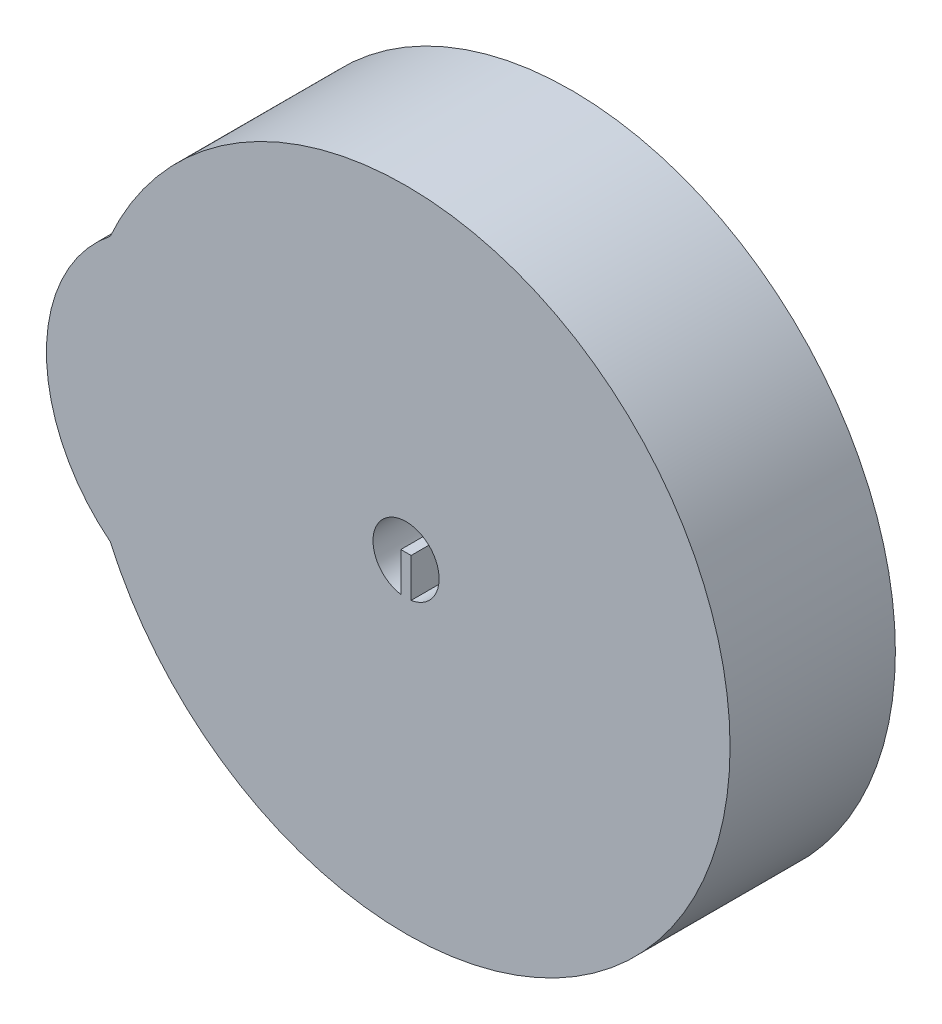
from build123d import *

# Parameters (mm, degrees)
SKETCH_1_R          = 49
EXTRUDE_1_DEPTH     = 25
SKETCH_2_R          = 5
CUT_EXTRUDE_1_DEPTH = 25
SKETCH_3_W          = 1.555795937
SKETCH_3_H          = 6.849823777
EXTRUDE_4_DEPTH     = 25
EXTRUDE_5_DEPTH     = 25


with BuildPart() as part:
    # 草图1 → 凸台-拉伸1 (new body)
    with BuildSketch(Plane.XY):
        Circle(SKETCH_1_R)
    extrude(amount=EXTRUDE_1_DEPTH)

    # 草图2 → 切除-拉伸1 (cut)
    with BuildSketch(Plane(origin=(0, 0, 0), x_dir=(-1, 0, 0), z_dir=(0, 0, -1))):
        Circle(SKETCH_2_R)
    extrude(amount=-CUT_EXTRUDE_1_DEPTH, mode=Mode.SUBTRACT)

    # 草图3 → 凸台-拉伸4 (add)
    with BuildSketch(Plane(origin=(0, 0, 0), x_dir=(-1, 0, 0), z_dir=(0, 0, -1))):
        with Locations((0.010297919, -2.475862613)):
            Rectangle(SKETCH_3_W, SKETCH_3_H)
    extrude(amount=-EXTRUDE_4_DEPTH)

    # 草图7 → 凸台-拉伸5 (add)
    with BuildSketch(Plane(origin=(0, 0, 0), x_dir=(-1, 0, 0), z_dir=(0, 0, -1))):
        with BuildLine():
            ThreePointArc((44.732538493, 20), (54.385039322, 0), (44.732538493, -20))
            ThreePointArc((44.732538493, -20), (49, 0), (44.732538493, 20))
        make_face()
    extrude(amount=-EXTRUDE_5_DEPTH)


solid = part.part
